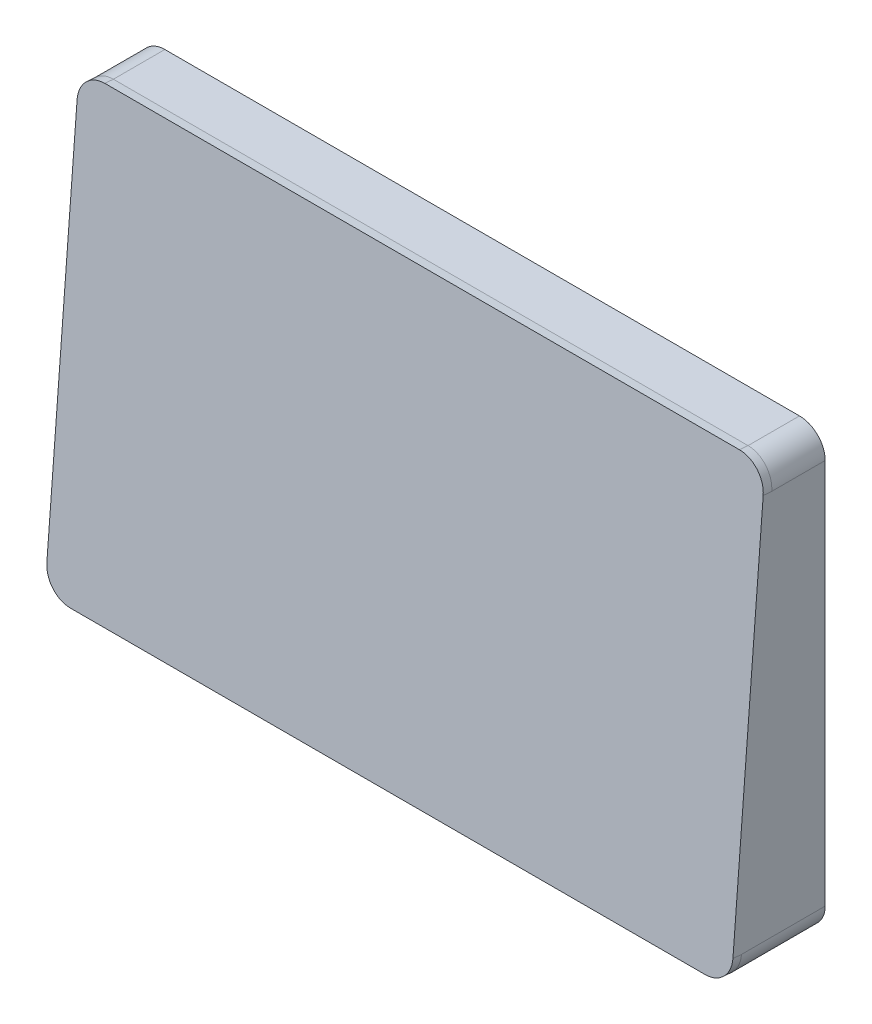
from build123d import *

# Parameters (mm, degrees)
BOSS_EXTRUDE1_DEPTH = 20
CUT_EXTRUDE1_DEPTH  = 188.710441905
BOSS_EXTRUDE2_DEPTH = 2
SKETCH4_W           = 9
SKETCH4_H           = 4.5
CUT_EXTRUDE2_DEPTH  = 185.20565812
SKETCH5_R           = 1
CUT_EXTRUDE3_DEPTH  = 185.20565812


with BuildPart() as part:
    # Sketch1 → Boss-Extrude1 (new body)
    with BuildSketch(Plane.XY):
        with BuildLine():
            Line((-153.675, 0.1), (-153.675, 90.1))
            ThreePointArc((-153.675, 90.1), (-151.917640687, 94.342640687), (-147.675, 96.1))
            Line((-147.675, 96.1), (0.325, 96.1))
            ThreePointArc((0.325, 96.1), (4.567640687, 94.342640687), (6.325, 90.1))
            Line((6.325, 90.1), (6.325, 0.1))
            ThreePointArc((6.325, 0.1), (4.567640687, -4.142640687), (0.325, -5.9))
            Line((0.325, -5.9), (-147.675, -5.9))
            ThreePointArc((-147.675, -5.9), (-151.917640687, -4.142640687), (-153.675, 0.1))
        make_face()
        with BuildLine():
            Line((3.325, 90.1), (3.325, 0.1))
            ThreePointArc((3.325, 0.1), (2.446320344, -2.021320344), (0.325, -2.9))
            Line((0.325, -2.9), (-147.675, -2.9))
            ThreePointArc((-147.675, -2.9), (-149.796320344, -2.021320344), (-150.675, 0.1))
            Line((-150.675, 0.1), (-150.675, 90.1))
            ThreePointArc((-150.675, 90.1), (-149.796320344, 92.221320344), (-147.675, 93.1))
            Line((-147.675, 93.1), (0.325, 93.1))
            ThreePointArc((0.325, 93.1), (2.446320344, 92.221320344), (3.325, 90.1))
        make_face(mode=Mode.SUBTRACT)
    extrude(amount=BOSS_EXTRUDE1_DEPTH)

    # Sketch2 → Cut-Extrude1 (cut, through all)
    with BuildSketch(Plane(origin=(6.325, 0, 0), x_dir=(0, 0, -1), z_dir=(1, 0, 0))):
        Polygon((-20, 96.1), (-12, 96.1), (-20, -5.9), align=None)
    extrude(amount=-CUT_EXTRUDE1_DEPTH, mode=Mode.SUBTRACT)

    # Sketch3 → Boss-Extrude2 (add)
    with BuildSketch(Plane(origin=(0, 1.522965227, 19.417806649), x_dir=(1, 0, 0), z_dir=(0, 0.0781912453186315, 0.9969383778125516))):
        with BuildLine():
            Line((-153.675, 88.849057017), (-153.675, -1.427335188))
            add(Edge.make_bspline(
                [(-153.675, -1.427335188), (-153.675, -7.445761335), (-147.675, -7.445761335)],
                knots=[1.570796327, 1.570796327, 1.570796327, 3.141592654, 3.141592654, 3.141592654], degree=2, weights=[1, 0.707106781, 1]))
            Line((-147.675, -7.445761335), (0.325, -7.445761335))
            add(Edge.make_bspline(
                [(0.325, -7.445761335), (6.325, -7.445761335), (6.325, -1.427335188)],
                knots=[3.141592654, 3.141592654, 3.141592654, 4.71238898, 4.71238898, 4.71238898], degree=2, weights=[1, 0.707106781, 1]))
            Line((6.325, -1.427335188), (6.325, 88.849057017))
            add(Edge.make_bspline(
                [(6.325, 88.849057017), (6.325, 94.867483164), (0.325, 94.867483164)],
                knots=[4.71238898, 4.71238898, 4.71238898, 6.283185307, 6.283185307, 6.283185307], degree=2, weights=[1, 0.707106781, 1]))
            Line((0.325, 94.867483164), (-147.675, 94.867483164))
            add(Edge.make_bspline(
                [(-147.675, 94.867483164), (-153.675, 94.867483164), (-153.675, 88.849057017)],
                knots=[0, 0, 0, 1.570796327, 1.570796327, 1.570796327], degree=2, weights=[1, 0.707106781, 1]))
        make_face()
    extrude(amount=BOSS_EXTRUDE2_DEPTH)

    # Sketch4 → Cut-Extrude2 (cut, through all)
    with BuildSketch(Plane(origin=(0, -2.9, 0), x_dir=(1, 0, 0), z_dir=(0, 1, 0))):
        with Locations((-131.175, -10.25)):
            Rectangle(SKETCH4_W, SKETCH4_H)
    extrude(amount=-CUT_EXTRUDE2_DEPTH, mode=Mode.SUBTRACT)

    # Sketch5 → Cut-Extrude3 (cut, through all)
    with BuildSketch(Plane(origin=(0, -2.9, 0), x_dir=(1, 0, 0), z_dir=(0, 1, 0))):
        with Locations(Location((-5.675, -10.25, 0), (0, 0, 180))):
            Circle(SKETCH5_R)
        with Locations(Location((-9.675, -10.25, 0), (0, 0, 180))):
            Circle(SKETCH5_R)
    extrude(amount=-CUT_EXTRUDE3_DEPTH, mode=Mode.SUBTRACT)


solid = part.part
